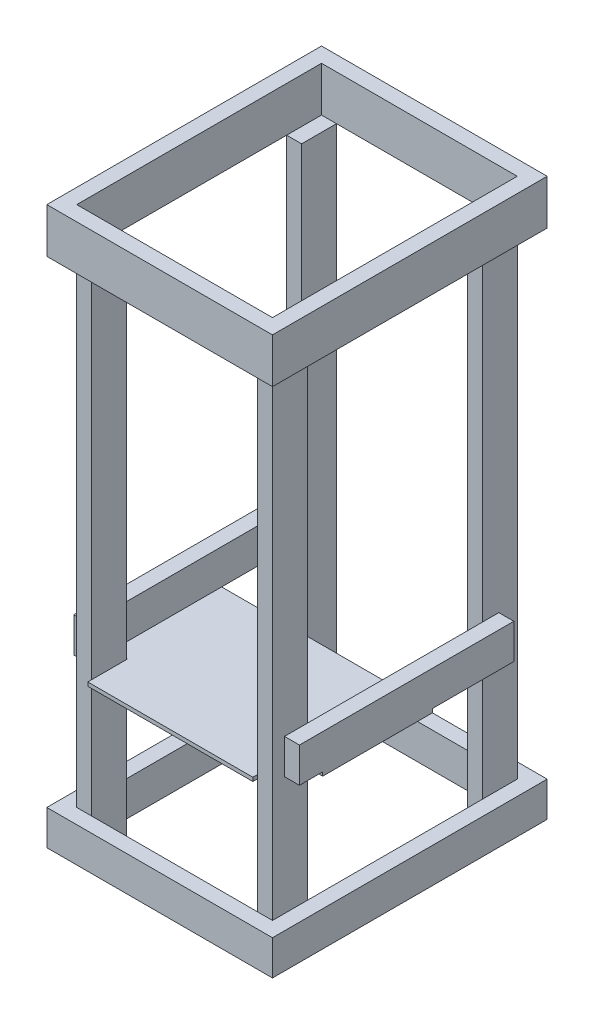
from build123d import *

# Parameters (mm, degrees)
SKETCH1_W             = 575
SKETCH1_H             = 700
SKETCH1_W_2           = 498.8
SKETCH1_H_2           = 623.8
BOSS_EXTRUDE1_DEPTH   = 114.3
SKETCH2_W             = 38.1
SKETCH2_H             = 88.9
BOSS_EXTRUDE2_DEPTH   = 1305
BOSS_EXTRUDE2_2_DEPTH = 1305
BOSS_EXTRUDE2_3_DEPTH = 1305
BOSS_EXTRUDE2_4_DEPTH = 1305
SKETCH3_W             = 575
SKETCH3_H             = 700
SKETCH3_W_2           = 498.8
SKETCH3_H_2           = 623.8
BOSS_EXTRUDE3_DEPTH   = 88.9
SKETCH7_W             = 38.1
SKETCH7_H             = 546.2345493
BOSS_EXTRUDE4_DEPTH   = 88.9
BOSS_EXTRUDE8_DEPTH   = 9.525


with BuildPart() as part:
    # Sketch1 → Boss-Extrude1 (new body)
    with BuildSketch(Plane(origin=(0, 0, 0), x_dir=(1, 0, 0), z_dir=(0, 1, 0))):
        Rectangle(SKETCH1_W, SKETCH1_H)
        Rectangle(SKETCH1_W_2, SKETCH1_H_2, mode=Mode.SUBTRACT)
    extrude(amount=BOSS_EXTRUDE1_DEPTH)


with BuildPart() as body_2:
    # Sketch2 → Boss-Extrude2 (new body)
    with BuildSketch(Plane.XZ):
        with Locations((-230.35, 267.45)):
            Rectangle(SKETCH2_W, SKETCH2_H)
    extrude(amount=BOSS_EXTRUDE2_DEPTH)



with BuildPart() as body_3:
    # Sketch2 → Boss-Extrude2 2 (new body)
    with BuildSketch(Plane.XZ):
        with Locations((-230.35, -267.45)):
            Rectangle(SKETCH2_W, SKETCH2_H)
    extrude(amount=BOSS_EXTRUDE2_2_DEPTH)


with BuildPart() as body_4:
    # Sketch2 → Boss-Extrude2 3 (new body)
    with BuildSketch(Plane.XZ):
        with Locations((230.35, 267.45)):
            Rectangle(SKETCH2_W, SKETCH2_H)
    extrude(amount=BOSS_EXTRUDE2_3_DEPTH)


with BuildPart() as body_5:
    # Sketch2 → Boss-Extrude2 4 (new body)
    with BuildSketch(Plane.XZ):
        with Locations((230.35, -267.45)):
            Rectangle(SKETCH2_W, SKETCH2_H)
    extrude(amount=BOSS_EXTRUDE2_4_DEPTH)


with BuildPart() as body_2_1:
    add(body_2.part)

    add(body_3.part)  # Boss-Extrude3 merges body 3

    add(body_4.part)  # Boss-Extrude3 merges body 4

    add(body_5.part)  # Boss-Extrude3 merges body 5
    # Sketch3 → Boss-Extrude3 (add)
    with BuildSketch(Plane.XZ.offset(1305)):
        Rectangle(SKETCH3_W, SKETCH3_H)
        Rectangle(SKETCH3_W_2, SKETCH3_H_2, mode=Mode.SUBTRACT)
    extrude(amount=-BOSS_EXTRUDE3_DEPTH)

    # Sketch7 → Boss-Extrude4 (add)
    with BuildSketch(Plane(origin=(0, -914.1, 0), x_dir=(1, 0, 0), z_dir=(0, 1, 0))):
        with Locations((-268.45, -8.198642391)):
            Rectangle(SKETCH7_W, SKETCH7_H)
        with Locations((268.45, -8.198642391)):
            Rectangle(SKETCH7_W, SKETCH7_H)
    extrude(amount=BOSS_EXTRUDE4_DEPTH)

    # Sketch8 → Boss-Extrude8 (add)
    with BuildSketch(Plane.XZ.offset(914.1)):
        Polygon((-287.5, 222), (-287.5, -57.4), (287.5, -57.4), (287.5, 222), (210.3, 222), (210.3, 322.85640623), (-210.3, 322.85640623), (-210.3, 222), align=None)
    extrude(amount=BOSS_EXTRUDE8_DEPTH)


solid = Compound([part.part, body_2_1.part])
